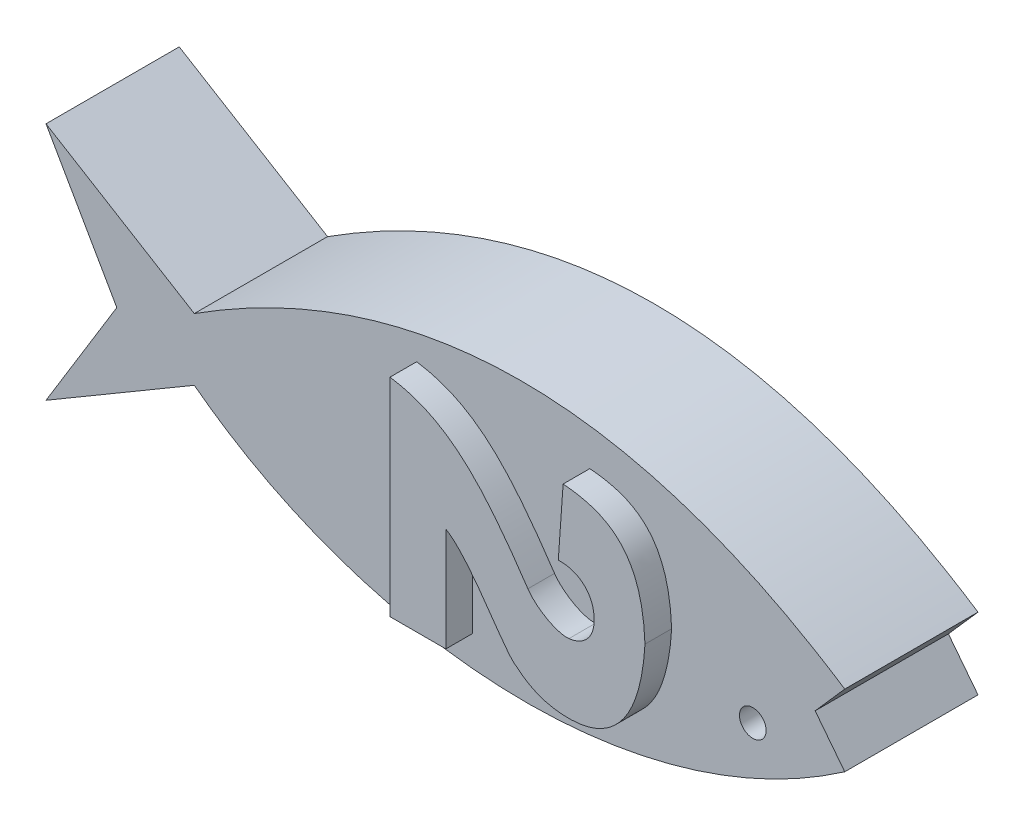
from build123d import *

# Parameters (mm, degrees)
SKETCH2_R           = 0.500109693
BOSS_EXTRUDE1_DEPTH = 5
BOSS_EXTRUDE2_DEPTH = 1


with BuildPart() as part:
    # Sketch2 → Boss-Extrude1 (new body)
    with BuildSketch(Plane(origin=(0, 0, 0), x_dir=(1, 0, 0), z_dir=(0, 0, -1))):
        with BuildLine():
            Line((29.97295835, 6.642737104), (28.862437793, 5.215722686))
            Line((28.862437793, 5.215722686), (29.97295835, 3.953817374))
            add(Edge.make_bspline(
                [(5.565346412, 3.953817374), (17.919076804, -3.939717318), (29.97295835, 3.953817374)],
                knots=[0, 0, 0, 1, 1, 1], degree=2))
            Line((5.565346412, 3.953817374), (0, 0.570103483))
            Line((0, 0.570103483), (2.65645961, 5.215722686))
            Line((2.65645961, 5.215722686), (0, 9.556126627))
            Line((0, 9.556126627), (5.565346412, 6.285726684))
            add(Edge.make_bspline(
                [(5.565346412, 6.285726684), (12.037313538, 11.217277608), (22.14175538, 12.07873787), (29.97295835, 6.642737104)],
                knots=[0, 0, 0, 0, 1, 1, 1, 1], degree=3))
        make_face()
        with Locations(Location((26.5225963, 6.780666166, 0), (0, 0, 180))):
            Circle(SKETCH2_R, mode=Mode.SUBTRACT)
    extrude(amount=-BOSS_EXTRUDE1_DEPTH)

    # Sketch4 → Boss-Extrude2 (add)
    with BuildSketch(Plane(origin=(0, 0, 5), x_dir=(-1, 0, 0), z_dir=(0, 0, 1))):
        with BuildLine():
            Line((-13.908305334, 1.34956402), (-13.908305334, 9.133973525))
            Line((-13.908305334, 9.133973525), (-16.004621445, 9.133973525))
            Line((-16.004621445, 9.133973525), (-16.004621445, 5.241768773))
            add(Edge.make_bspline(
                [(-16.004621445, 5.241768773), (-16.954182776, 5.785448359), (-18.2214925, 8.172395217), (-18.647004572, 8.368785404)],
                knots=[0, 0, 0, 0, 1, 1, 1, 1], degree=3))
            add(Edge.make_bspline(
                [(-18.647004572, 8.368785404), (-19.182278095, 8.856654309), (-19.866173762, 9.102220728), (-20.698347409, 9.084883777)],
                knots=[0, 0, 0, 0, 1, 1, 1, 1], degree=3))
            add(Edge.make_bspline(
                [(-20.698347409, 9.084883777), (-22.350260741, 9.040072434), (-23.33079469, 7.762774595), (-23.476488694, 5.241768773)],
                knots=[0, 0, 0, 0, 1, 1, 1, 1], degree=3))
            add(Edge.make_bspline(
                [(-20.404496328, 1.575368175), (-22.334339213, 1.71536757), (-23.381711079, 2.669128019), (-23.476488694, 5.241768773)],
                knots=[0, 0, 0, 0, 1, 1, 1, 1], degree=3))
            Line((-20.404496328, 1.575368175), (-20.223319436, 4.140832963))
            add(Edge.make_bspline(
                [(-21.56956029, 5.431442564), (-21.582844794, 4.484850448), (-20.84335959, 4.096124714), (-20.223319436, 4.140832963)],
                knots=[0, 0, 0, 0, 1, 1, 1, 1], degree=3))
            add(Edge.make_bspline(
                [(-20.623882844, 6.487488573), (-21.093503681, 6.435159023), (-21.557848723, 6.102593618), (-21.56956029, 5.431442564)],
                knots=[0, 0, 0, 0, 1, 1, 1, 1], degree=3))
            add(Edge.make_bspline(
                [(-19.082560895, 5.639341249), (-19.40985103, 6.125934593), (-20.210193184, 6.544584723), (-20.623882844, 6.487488573)],
                knots=[0, 0, 0, 0, 1, 1, 1, 1], degree=3))
            add(Edge.make_bspline(
                [(-13.908305334, 1.34956402), (-16.125553437, 1.670916535), (-17.437876782, 3.20471995), (-19.082560895, 5.639341249)],
                knots=[0, 0, 0, 0, 1, 1, 1, 1], degree=3))
        make_face()
    extrude(amount=BOSS_EXTRUDE2_DEPTH)


solid = part.part
